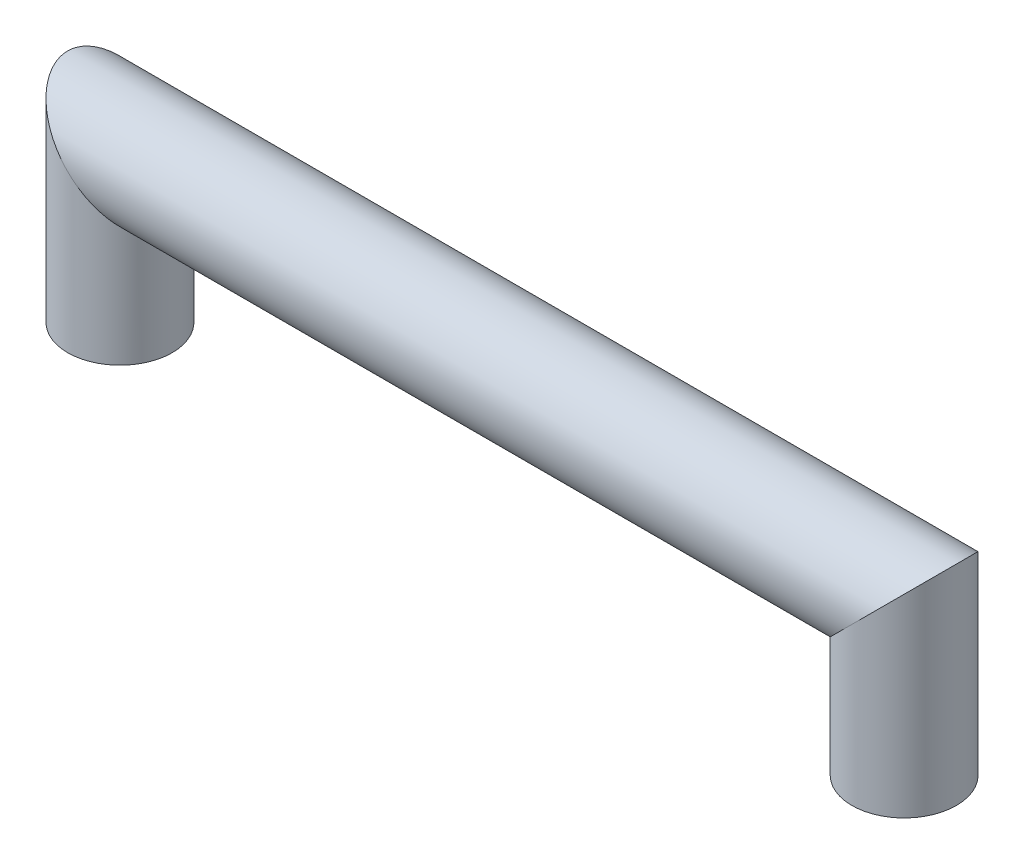
from build123d import *

# Parameters (mm, degrees)
SKETCH2_R = 1


with BuildPart() as part:
    # Sweep1: sweep along a path in Sketch1
    with BuildLine(Plane.XY) as sweep1_path:
        Line((-7.5, 0), (-7.5, 3))
        Line((-7.5, 3), (7.5, 3))
        Line((7.5, 3), (7.5, 0))
    # Sketch2 → Sweep1 (sweep)
    with BuildSketch(Plane(origin=(0, 0, 0), x_dir=(1, 0, 0), z_dir=(0, 1, 0))):
        with Locations((-7.5, 0)):
            Circle(SKETCH2_R)
    sweep(path=sweep1_path.line, transition=Transition.RIGHT)


solid = part.part
